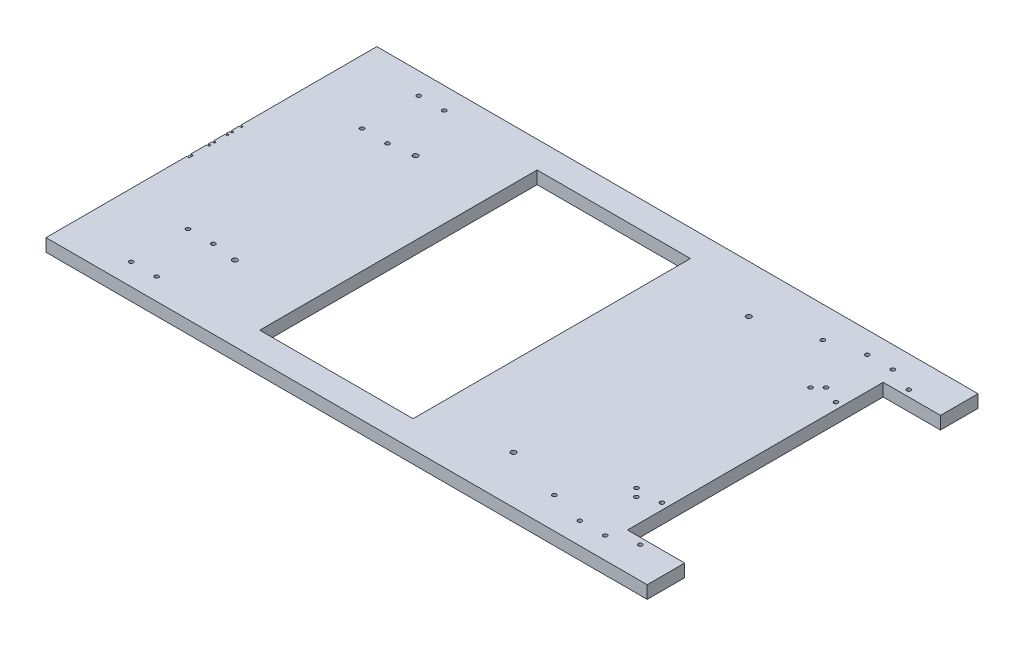
from build123d import *

# Parameters (mm, degrees)
SKETCH1_W               = 600.075
SKETCH1_H               = 330.2
BOSS_EXTRUDE1_DEPTH     = 12.7
CUT_EXTRUDE1_DEPTH      = 2.54
CUT_EXTRUDE2_DEPTH      = 2.54
CUT_EXTRUDE3_REACH      = 344.698
SKETCH4_W               = 153.035
SKETCH4_H               = 276.86
F_5_0MM_DOWEL_HOLE2_D   = 5
CUT_EXTRUDE4_REACH      = 344.698
SKETCH18_W              = 57.15
SKETCH18_H              = 255.27
SKETCH19_R              = 2.032
CUT_EXTRUDE5_DEPTH      = 12.7
CUT_EXTRUDE6_REACH      = 344.698
SKETCH20_R              = 2.0193
CUT_EXTRUDE7_REACH      = 344.698
SKETCH21_R              = 2.0193
LPATTERN1_COUNT         = 2
LPATTERN1_PITCH         = 447.675
MIRROR5_COPY_1_REACH    = 344.698
MIRROR5_COPY_1_SKETCH_R = 2.0193
MIRROR5_COPY_2_REACH    = 344.698
MIRROR5_COPY_2_SKETCH_R = 2.0193
CUT_EXTRUDE8_REACH      = 344.698
SKETCH22_R              = 2.032
SKETCH23_R              = 3.6068
SKETCH23_R_2            = 2.0193
SKETCH23_R_3            = 4.08813
SKETCH23_R_4            = 2.50063
SKETCH23_R_5            = 3.6195
SKETCH23_R_6            = 2.032
BOSS_EXTRUDE2_DEPTH     = 12.7


with BuildPart() as part:
    # Sketch1 → Boss-Extrude1 (new body)
    with BuildSketch(Plane(origin=(0, 0, 0), x_dir=(1, 0, 0), z_dir=(0, 1, 0))):
        Rectangle(SKETCH1_W, SKETCH1_H)
    extrude(amount=BOSS_EXTRUDE1_DEPTH)

    # Sketch2 → Cut-Extrude1 (cut)
    # profile 1 of 4: a face of its own
    with BuildSketch(Plane.ZY.offset(300.0375)):
        with BuildLine():
            Line((-29.307692308, 25.4), (-25.590805288, 25.4))
            add(Edge.make_bspline(
                [(-25.590805288, 25.4), (-25.408858857, 25.399043416), (-25.056201391, 25.397189317), (-24.543378429, 25.368433989), (-24.06305276, 25.329225443), (-23.615085084, 25.267013082), (-23.199682404, 25.191946409), (-22.815592836, 25.10104081), (-22.464037755, 24.992038813), (-22.044324147, 24.818704053), (-21.56578455, 24.561130809), (-21.047633298, 24.180519618), (-20.604561653, 23.71497864), (-20.222547555, 23.18983733), (-19.918830032, 22.612155487), (-19.699105714, 21.995701902), (-19.559997849, 21.34842785), (-19.545691658, 20.904055696), (-19.538461538, 20.679477163)],
                knots=[0, 0, 0, 0, 1.001505555, 1.941167018, 2.826882275, 3.653841531, 4.429895133, 5.150066043, 5.825578002, 6.45369114, 7.647487171, 8.808567382, 9.977351308, 11.170798116, 12.373658725, 13.556498008, 14.765093433, 16, 16, 16, 16], degree=3))
            add(Edge.make_bspline(
                [(-19.538461538, 20.679477163), (-19.54441177, 20.469096825), (-19.556104537, 20.055679619), (-19.667915841, 19.451010253), (-19.842961765, 18.875421476), (-20.08628605, 18.331013921), (-20.402526915, 17.830088113), (-20.777312907, 17.368603136), (-21.229488074, 16.966098097), (-21.568269138, 16.741074585), (-21.740354567, 16.626772837)],
                knots=[0, 0, 0, 0, 1.044552857, 2.05264487, 3.044412934, 4.028983338, 5.005914585, 5.980388656, 6.974128949, 8, 8, 8, 8], degree=3))
            add(Edge.make_bspline(
                [(-21.740354567, 16.626772837), (-21.52394424, 16.543687628), (-21.109897675, 16.384725042), (-20.540106664, 16.103680588), (-20.049189008, 15.797998245), (-19.633370256, 15.464177746), (-19.277746735, 15.104356933), (-18.967215724, 14.713259811), (-18.702249959, 14.285784572), (-18.475212475, 13.826388187), (-18.298054246, 13.339761552), (-18.165379681, 12.830469185), (-18.08935685, 12.30033732), (-18.078538403, 11.939555469), (-18.073076923, 11.757421875)],
                knots=[0, 0, 0, 0, 1.27268992, 2.434971085, 3.483601985, 4.442670788, 5.356604649, 6.2567628, 7.179492994, 8.113709626, 9.066344395, 10.018646069, 10.999752585, 12, 12, 12, 12], degree=3))
            add(Edge.make_bspline(
                [(-18.073076923, 11.757421875), (-18.078393756, 11.571456471), (-18.088854775, 11.205564329), (-18.166034336, 10.668054239), (-18.296712475, 10.154384887), (-18.476714, 9.661233821), (-18.711640313, 9.189555089), (-18.997542519, 8.738814324), (-19.338437172, 8.313540324), (-19.719779359, 7.909007461), (-20.151191894, 7.545273362), (-20.616641931, 7.221337873), (-21.121991186, 6.954931449), (-21.658939897, 6.731142817), (-22.233511389, 6.560197923), (-22.84312558, 6.440604342), (-23.487256709, 6.360022641), (-23.929269783, 6.353397568), (-24.155949519, 6.35)],
                knots=[0, 0, 0, 0, 0.978564426, 1.925352924, 2.850884081, 3.763762016, 4.682927383, 5.618979971, 6.567305752, 7.547517671, 8.540179244, 9.531824382, 10.526200242, 11.540722885, 12.589160233, 13.674978461, 14.80764778, 16, 16, 16, 16], degree=3))
            Line((-24.155949519, 6.35), (-29.307692308, 6.35))
            Line((-29.307692308, 6.35), (-29.307692308, 25.4))
        make_face()
        with BuildLine():
            Line((-27.598076923, 23.446153846), (-27.598076923, 17.340384615))
            Line((-27.598076923, 17.340384615), (-26.449429087, 17.340384615))
            add(Edge.make_bspline(
                [(-26.449429087, 17.340384615), (-26.2815235, 17.342561339), (-25.957095691, 17.346767213), (-25.487268825, 17.35881507), (-25.051159798, 17.392550135), (-24.649521392, 17.426275504), (-24.28298609, 17.481110046), (-23.952365929, 17.546381458), (-23.652472137, 17.615412698), (-23.306635468, 17.732812334), (-22.914352706, 17.906317966), (-22.496161096, 18.175586103), (-22.127492054, 18.496302939), (-21.816175933, 18.866368031), (-21.561387786, 19.273853986), (-21.384420279, 19.712259149), (-21.264420061, 20.170657296), (-21.25358044, 20.485353787), (-21.248076923, 20.645132212)],
                knots=[0, 0, 0, 0, 1.156816544, 2.235205308, 3.236616184, 4.169592532, 5.011045266, 5.787822928, 6.49130361, 7.128639758, 8.301311294, 9.436451833, 10.541879658, 11.654887649, 12.756523258, 13.837046038, 14.901820046, 16, 16, 16, 16], degree=3))
            add(Edge.make_bspline(
                [(-21.248076923, 20.645132212), (-21.250940847, 20.750863911), (-21.256558745, 20.958268185), (-21.302568864, 21.260615384), (-21.380769519, 21.544970665), (-21.481213601, 21.815230894), (-21.621577749, 22.062945393), (-21.786841743, 22.296679073), (-21.986516714, 22.508472175), (-22.213795801, 22.706426159), (-22.475099877, 22.881928517), (-22.770273051, 23.035638957), (-23.103308837, 23.159413755), (-23.468594519, 23.267814528), (-23.871752866, 23.343950813), (-24.308131507, 23.407378537), (-24.781304763, 23.439669604), (-25.108665964, 23.443944222), (-25.277884615, 23.446153846)],
                knots=[0, 0, 0, 0, 0.91205012, 1.789085906, 2.630437955, 3.453916878, 4.269457761, 5.079663411, 5.91843418, 6.774407191, 7.675494373, 8.627863946, 9.638891023, 10.736472738, 11.911756761, 13.175263542, 14.539845004, 16, 16, 16, 16], degree=3))
            Line((-25.277884615, 23.446153846), (-27.598076923, 23.446153846))
        make_face(mode=Mode.SUBTRACT)
        with BuildLine():
            Line((-27.598076923, 15.386538462), (-27.598076923, 8.303846154))
            Line((-27.598076923, 8.303846154), (-25.163401442, 8.303846154))
            add(Edge.make_bspline(
                [(-25.163401442, 8.303846154), (-24.989127003, 8.305934836), (-24.653235995, 8.309960496), (-24.168270728, 8.323102571), (-23.718782692, 8.352996243), (-23.306822982, 8.400054368), (-22.927943233, 8.451099927), (-22.586688592, 8.519741327), (-22.280292782, 8.598384955), (-21.92501405, 8.719946664), (-21.524944954, 8.908794599), (-21.093811579, 9.19353346), (-20.710491735, 9.532750321), (-20.384980252, 9.925348582), (-20.118209558, 10.35223909), (-19.924142009, 10.804787352), (-19.804448918, 11.275515723), (-19.78995911, 11.596463115), (-19.782692308, 11.757421875)],
                knots=[0, 0, 0, 0, 1.160039823, 2.235823828, 3.228722157, 4.157150951, 4.99529583, 5.772374946, 6.472645482, 7.099169577, 8.269452708, 9.405989375, 10.527446681, 11.663510218, 12.788923519, 13.866172445, 14.929861265, 16, 16, 16, 16], degree=3))
            add(Edge.make_bspline(
                [(-19.782692308, 11.757421875), (-19.784195104, 11.858078486), (-19.787176457, 12.057768106), (-19.832137804, 12.351224208), (-19.897527581, 12.635482176), (-19.982062957, 12.911313877), (-20.105177485, 13.173732397), (-20.248904537, 13.427927757), (-20.417423023, 13.674235981), (-20.680009126, 13.985634103), (-21.061945213, 14.344410988), (-21.604634948, 14.695679393), (-22.22170417, 14.978968171), (-22.669256667, 15.099252464), (-22.900450721, 15.161388221)],
                knots=[0, 0, 0, 0, 0.723448775, 1.435228256, 2.130040452, 2.821711965, 3.505591119, 4.210454504, 4.921174351, 5.648778258, 7.137944449, 8.670945889, 10.280296675, 12, 12, 12, 12], degree=3))
            add(Edge.make_bspline(
                [(-22.900450721, 15.161388221), (-22.993137657, 15.18019375), (-23.194102053, 15.220968014), (-23.521803312, 15.264008514), (-23.895922827, 15.302353768), (-24.317324487, 15.330717355), (-24.786541451, 15.360035542), (-25.304575823, 15.371437354), (-25.869312064, 15.38504047), (-26.261156262, 15.386026358), (-26.46469351, 15.386538462)],
                knots=[0, 0, 0, 0, 0.634451884, 1.375622551, 2.216452059, 3.157844607, 4.20941857, 5.370758133, 6.634282058, 8, 8, 8, 8], degree=3))
            Line((-26.46469351, 15.386538462), (-27.598076923, 15.386538462))
        make_face(mode=Mode.SUBTRACT)
    # profile 2 of 4: a face of its own
    with BuildSketch(Plane.ZY.offset(300.0375)):
        with BuildLine():
            Line((-0.488461538, 20.271153846), (-0.488461538, 6.35))
            Line((-0.488461538, 6.35), (-2.198076923, 6.35))
            Line((-2.198076923, 6.35), (-2.198076923, 8.75796274))
            add(Edge.make_bspline(
                [(-2.198076923, 8.75796274), (-2.390856341, 8.54003295), (-2.767067798, 8.114740225), (-3.395397312, 7.559121543), (-4.061429823, 7.099862393), (-4.761932728, 6.728932138), (-5.496273452, 6.450301088), (-6.262824156, 6.252256422), (-7.061897529, 6.124927119), (-7.607556774, 6.112212486), (-7.884074519, 6.105769231)],
                knots=[0, 0, 0, 0, 1.074387032, 2.096679803, 3.090159297, 4.057316773, 5.018401886, 5.985159533, 6.978961417, 8, 8, 8, 8], degree=3))
            add(Edge.make_bspline(
                [(-7.884074519, 6.105769231), (-8.129917239, 6.1124442), (-8.614729969, 6.125607534), (-9.327902517, 6.227728073), (-10.014204618, 6.391724742), (-10.674284792, 6.619785298), (-11.303871755, 6.92230377), (-11.908355995, 7.284478277), (-12.484605933, 7.715774795), (-13.023838167, 8.208832492), (-13.520400912, 8.744382351), (-13.956162981, 9.31558597), (-14.319490459, 9.919973367), (-14.623311184, 10.54989239), (-14.857334144, 11.210192167), (-15.020476354, 11.898589324), (-15.122477928, 12.614269921), (-15.135635821, 13.101620754), (-15.142307692, 13.348737981)],
                knots=[0, 0, 0, 0, 1.033919861, 2.038935746, 3.024066025, 3.998881131, 4.97069526, 5.957263378, 6.95902576, 7.993208707, 9.027059324, 10.027763471, 11.009749337, 11.988697705, 12.965288445, 13.950418724, 14.960734635, 16, 16, 16, 16], degree=3))
            add(Edge.make_bspline(
                [(-15.142307692, 13.348737981), (-15.135487948, 13.590747567), (-15.122005682, 14.069187465), (-15.021567442, 14.772832949), (-14.852670095, 15.450568054), (-14.615645381, 16.100210845), (-14.311705598, 16.722547404), (-13.941982724, 17.318017883), (-13.50645006, 17.888262746), (-13.004333387, 18.419873281), (-12.46040271, 18.910931195), (-11.87851376, 19.337700429), (-11.273141329, 19.706273563), (-10.634895514, 19.99830177), (-9.97322313, 20.234571324), (-9.282233661, 20.398036479), (-8.564802068, 20.494360471), (-8.077718104, 20.50830923), (-7.830649038, 20.515384615)],
                knots=[0, 0, 0, 0, 1.020392517, 2.01726096, 2.990465484, 3.961182959, 4.928053699, 5.906110375, 6.912531644, 7.948652711, 8.985773172, 9.998621852, 10.987621588, 11.969261332, 12.953316658, 13.946091881, 14.958173133, 16, 16, 16, 16], degree=3))
            add(Edge.make_bspline(
                [(-7.830649038, 20.515384615), (-7.546532663, 20.507559139), (-6.989393859, 20.49221375), (-6.174445694, 20.364509477), (-5.403495036, 20.148762962), (-4.670590634, 19.855297723), (-3.978364329, 19.465323926), (-3.333369514, 18.97339871), (-2.728855955, 18.382624535), (-2.378443224, 17.928851116), (-2.198076923, 17.695282452)],
                knots=[0, 0, 0, 0, 1.038897134, 2.037228247, 3.008116434, 3.962042015, 4.918381754, 5.904844433, 6.921570401, 8, 8, 8, 8], degree=3))
            Line((-2.198076923, 17.695282452), (-2.198076923, 20.271153846))
            Line((-2.198076923, 20.271153846), (-0.488461538, 20.271153846))
        make_face()
        with BuildLine():
            add(Edge.make_bspline(
                [(-7.807752404, 18.805769231), (-8.057657586, 18.796877574), (-8.550930666, 18.779326858), (-9.275070162, 18.64231112), (-9.968018888, 18.414339256), (-10.626311092, 18.102562051), (-11.2395481, 17.710519928), (-11.787609365, 17.236330684), (-12.274977497, 16.692932079), (-12.684869621, 16.082776306), (-13.019009325, 15.428664125), (-13.253961313, 14.744908255), (-13.40891536, 14.043841163), (-13.424746022, 13.568338544), (-13.432692308, 13.329657452)],
                knots=[0, 0, 0, 0, 1.031046209, 2.035121221, 3.029706178, 4.034933723, 5.034054252, 6.02443088, 7.017295772, 8.038157696, 9.050218397, 10.03989886, 11.016116709, 12, 12, 12, 12], degree=3))
            add(Edge.make_bspline(
                [(-13.432692308, 13.329657452), (-13.42254196, 13.092402726), (-13.40228105, 12.618823232), (-13.256680842, 11.916800378), (-13.012406102, 11.232883378), (-12.679074304, 10.572877113), (-12.261679961, 9.960097938), (-11.777871723, 9.406340985), (-11.222970906, 8.930147655), (-10.608322618, 8.531526004), (-9.951870665, 8.209512855), (-9.261531695, 7.98545416), (-8.550282864, 7.840795097), (-8.066672304, 7.823897873), (-7.823016827, 7.815384615)],
                knots=[0, 0, 0, 0, 0.979072187, 1.954306742, 2.945804271, 3.96968567, 4.997920485, 5.998718438, 6.996577872, 8.005894225, 9.015743152, 10.005417472, 10.995077863, 12, 12, 12, 12], degree=3))
            add(Edge.make_bspline(
                [(-7.823016827, 7.815384615), (-7.575658005, 7.824419562), (-7.083685841, 7.842389174), (-6.357398017, 7.97999149), (-5.652575433, 8.207333092), (-4.978819233, 8.522469768), (-4.351170005, 8.913034805), (-3.787845843, 9.3702734), (-3.311508929, 9.902057874), (-2.907689154, 10.486492568), (-2.591048672, 11.127182149), (-2.360401835, 11.809358244), (-2.224037005, 12.533044602), (-2.206849934, 13.027603976), (-2.198076923, 13.280048077)],
                knots=[0, 0, 0, 0, 1.01762866, 2.023962475, 3.030623092, 4.058876274, 5.077231937, 6.066672613, 7.034107872, 8.005628644, 8.981990164, 9.965428785, 10.961468474, 12, 12, 12, 12], degree=3))
            add(Edge.make_bspline(
                [(-2.198076923, 13.280048077), (-2.203300196, 13.47238684), (-2.213581249, 13.850970393), (-2.292124777, 14.406835882), (-2.417065163, 14.93878659), (-2.593120745, 15.447381798), (-2.824394736, 15.929809525), (-3.103329005, 16.389533705), (-3.434828667, 16.824163327), (-3.813557341, 17.227713471), (-4.228113658, 17.595794644), (-4.666778229, 17.924348583), (-5.134748266, 18.194253188), (-5.624153853, 18.417634966), (-6.135844116, 18.595394053), (-6.673982775, 18.713981358), (-7.232849833, 18.795408248), (-7.614100506, 18.802279207), (-7.807752404, 18.805769231)],
                knots=[0, 0, 0, 0, 1.050140795, 2.067009409, 3.05949893, 4.030605086, 5.00011959, 5.97591094, 6.962425594, 7.979863591, 8.993523472, 9.986985069, 10.967611495, 11.937549037, 12.921786183, 13.919465291, 14.943216303, 16, 16, 16, 16], degree=3))
        make_face(mode=Mode.SUBTRACT)
    # profile 3 of 4: a face of its own
    with BuildSketch(Plane.ZY.offset(300.0375)):
        with BuildLine():
            Line((17.096153846, 17.252614183), (15.665114183, 16.363461538))
            add(Edge.make_bspline(
                [(15.665114183, 16.363461538), (15.508197344, 16.558470368), (15.199333188, 16.94231214), (14.662998202, 17.437666205), (14.091436076, 17.863118247), (13.474879845, 18.209848662), (12.814194276, 18.477753985), (12.111984871, 18.667329818), (11.368351766, 18.785462911), (10.858545469, 18.798889552), (10.597325721, 18.805769231)],
                knots=[0, 0, 0, 0, 1.026593902, 2.0206758, 2.988051866, 3.946915611, 4.916868779, 5.907761954, 6.927957743, 8, 8, 8, 8], degree=3))
            add(Edge.make_bspline(
                [(10.597325721, 18.805769231), (10.388543399, 18.80001699), (9.977352291, 18.788688107), (9.373705942, 18.71787385), (8.798709705, 18.589193777), (8.248759561, 18.419643569), (7.727766997, 18.192402706), (7.234366998, 17.915852462), (6.764183117, 17.594451528), (6.330840568, 17.222102702), (5.934442686, 16.817161383), (5.591004311, 16.383073412), (5.291990432, 15.932840861), (5.05737087, 15.455220664), (4.865373156, 14.961139575), (4.739062293, 14.441271303), (4.654890166, 13.902276005), (4.645259963, 13.534783327), (4.640384615, 13.348737981)],
                knots=[0, 0, 0, 0, 1.112346261, 2.190735716, 3.231507886, 4.247384806, 5.251966152, 6.253067467, 7.256802811, 8.280671706, 9.291813951, 10.270744147, 11.225547591, 12.165006084, 13.100104208, 14.043489273, 15.009504848, 16, 16, 16, 16], degree=3))
            add(Edge.make_bspline(
                [(4.640384615, 13.348737981), (4.650068831, 13.105065561), (4.669306776, 12.621003995), (4.820081864, 11.906476041), (5.066884995, 11.215648526), (5.404657011, 10.553426237), (5.831796842, 9.940592335), (6.333478937, 9.390953819), (6.909981376, 8.915160865), (7.55622449, 8.520703265), (8.257034494, 8.203594964), (9.004829207, 7.97767648), (9.793498012, 7.841319996), (10.333466164, 7.824142648), (10.608774038, 7.815384615)],
                knots=[0, 0, 0, 0, 0.966302908, 1.919585723, 2.883856336, 3.870342332, 4.860282998, 5.839159637, 6.814385684, 7.815993281, 8.834850808, 9.858348828, 10.908058873, 12, 12, 12, 12], degree=3))
            add(Edge.make_bspline(
                [(10.608774038, 7.815384615), (10.861078685, 7.822457593), (11.356924268, 7.836357871), (12.081734777, 7.953536943), (12.77177972, 8.145363006), (13.427034572, 8.412866644), (14.046301991, 8.758637837), (14.625580785, 9.18513561), (15.176397592, 9.680090535), (15.500231136, 10.062821207), (15.665114183, 10.257692308)],
                knots=[0, 0, 0, 0, 1.039848629, 2.043578496, 3.018386758, 3.987534228, 4.954977003, 5.934852016, 6.948509513, 8, 8, 8, 8], degree=3))
            Line((15.665114183, 10.257692308), (17.096153846, 9.318930288))
            add(Edge.make_bspline(
                [(17.096153846, 9.318930288), (17.01131221, 9.194339332), (16.841910537, 8.945570952), (16.558731604, 8.594810831), (16.253279378, 8.266488532), (15.926745522, 7.961044151), (15.583393711, 7.671168361), (15.21149466, 7.410719077), (14.823040061, 7.165056685), (14.413469645, 6.944006623), (13.987017989, 6.74530793), (13.544285159, 6.574450272), (13.087195036, 6.427655839), (12.615210189, 6.310975423), (12.127400113, 6.217843573), (11.625026389, 6.156046998), (11.108262038, 6.109917253), (10.758982186, 6.107163892), (10.582061298, 6.105769231)],
                knots=[0, 0, 0, 0, 0.954134338, 1.905101784, 2.851144739, 3.791306361, 4.734911809, 5.6936923, 6.663572882, 7.643865596, 8.638447847, 9.640600242, 10.646758161, 11.676244097, 12.717260333, 13.78922464, 14.880174919, 16, 16, 16, 16], degree=3))
            add(Edge.make_bspline(
                [(10.582061298, 6.105769231), (10.312036345, 6.110620339), (9.782785478, 6.120128548), (9.008144401, 6.224677535), (8.267841441, 6.382289704), (7.562129521, 6.60851517), (6.890898775, 6.899734018), (6.254775089, 7.255462367), (5.655864761, 7.678654252), (5.100090358, 8.161777326), (4.589651344, 8.685601386), (4.151358793, 9.250841653), (3.771200963, 9.836716499), (3.465924479, 10.456165491), (3.222917636, 11.10095559), (3.05688419, 11.776252182), (2.949498047, 12.476488022), (2.937069938, 12.954005566), (2.930769231, 13.19609375)],
                knots=[0, 0, 0, 0, 1.1129367, 2.181364009, 3.217532258, 4.231199276, 5.232079859, 6.230262199, 7.231623845, 8.250719726, 9.263571943, 10.242672461, 11.195837495, 12.138959767, 13.085126421, 14.0317438, 15.002148558, 16, 16, 16, 16], degree=3))
            add(Edge.make_bspline(
                [(2.930769231, 13.19609375), (2.933169619, 13.360350658), (2.937944386, 13.687084759), (2.992710021, 14.172016479), (3.063458853, 14.650490133), (3.183341793, 15.11644072), (3.321811517, 15.576935227), (3.498571197, 16.02642325), (3.705918989, 16.466993541), (3.94133316, 16.897511183), (4.206339044, 17.310893677), (4.499606899, 17.701438623), (4.810091072, 18.073837632), (5.152316767, 18.415234101), (5.511761169, 18.739281085), (5.898593602, 19.037321733), (6.310595309, 19.310231984), (6.741578822, 19.563058225), (7.191293322, 19.788171722), (7.657020485, 19.982118345), (8.135953973, 20.147867365), (8.628859901, 20.279088769), (9.132466643, 20.389129316), (9.650742783, 20.458350736), (10.181705592, 20.507261736), (10.541239087, 20.512654476), (10.723257212, 20.515384615)],
                knots=[0, 0, 0, 0, 0.990994727, 1.971252077, 2.943264845, 3.907940874, 4.872158414, 5.844625996, 6.82015047, 7.809835459, 8.804511986, 9.781214284, 10.756496977, 11.728388426, 12.696359165, 13.676225489, 14.672885716, 15.677705647, 16.690706858, 17.706033469, 18.721040654, 19.747369689, 20.783475414, 21.830280724, 22.901553713, 24, 24, 24, 24], degree=3))
            add(Edge.make_bspline(
                [(10.723257212, 20.515384615), (10.951204657, 20.510366894), (11.405960159, 20.500356532), (12.080551719, 20.416108439), (12.745207275, 20.289091659), (13.388265081, 20.100916685), (14.001928252, 19.873058788), (14.576342631, 19.617175299), (15.097986625, 19.320024672), (15.576563932, 18.994976621), (16.01296959, 18.628340834), (16.411683328, 18.215734395), (16.780881305, 17.759304673), (16.990195691, 17.422904907), (17.096153846, 17.252614183)],
                knots=[0, 0, 0, 0, 1.095225653, 2.184976855, 3.262915854, 4.344593502, 5.400796181, 6.407717688, 7.363229445, 8.282371371, 9.184954523, 10.097238608, 11.036792983, 12, 12, 12, 12], degree=3))
        make_face()
    # profile 4 of 4: a face of its own
    with BuildSketch(Plane.ZY.offset(300.0375)):
        Polygon((20.515384615, 25.888461538), (22.225, 25.888461538), (22.225, 14.592788462), (28.559735577, 20.271153846), (31.017307692, 20.271153846), (23.667487981, 13.676923077), (31.75, 6.35), (29.29624399, 6.35), (22.225, 12.764873798), (22.225, 6.35), (20.515384615, 6.35), align=None)
    extrude(amount=-CUT_EXTRUDE1_DEPTH, mode=Mode.SUBTRACT)

    # Sketch3 → Cut-Extrude2 (cut)
    # profile 1 of 5: a face of its own
    with BuildSketch(Plane(origin=(300.0375, 0, 0), x_dir=(0, 0, -1), z_dir=(1, 0, 0))):
        Polygon((-28.941346154, 25.4), (-19.660576923, 25.4), (-19.660576923, 23.446153846), (-27.231730769, 23.446153846), (-27.231730769, 17.584615385), (-19.660576923, 17.584615385), (-19.660576923, 15.630769231), (-27.231730769, 15.630769231), (-27.231730769, 6.35), (-28.941346154, 6.35), align=None)
    # profile 2 of 5: a face of its own
    with BuildSketch(Plane(origin=(300.0375, 0, 0), x_dir=(0, 0, -1), z_dir=(1, 0, 0))):
        with BuildLine():
            Line((-17.218269231, 20.271153846), (-15.508653846, 20.271153846))
            Line((-15.508653846, 20.271153846), (-15.508653846, 18.221905048))
            add(Edge.make_bspline(
                [(-15.508653846, 18.221905048), (-15.382440745, 18.412708914), (-15.14105917, 18.777619824), (-14.739850226, 19.260234162), (-14.32889638, 19.659821773), (-13.906230289, 19.978248068), (-13.468743773, 20.216716615), (-13.026038365, 20.39139442), (-12.571149022, 20.494685236), (-12.265467691, 20.508475579), (-12.112319712, 20.515384615)],
                knots=[0, 0, 0, 0, 1.2804753, 2.448899062, 3.506932113, 4.484331642, 5.4025378, 6.288909075, 7.142734305, 8, 8, 8, 8], degree=3))
            add(Edge.make_bspline(
                [(-12.112319712, 20.515384615), (-11.993522135, 20.508904749), (-11.749088399, 20.495572003), (-11.379068875, 20.401895944), (-10.997832372, 20.252336992), (-10.752128807, 20.111692352), (-10.624038462, 20.038371394)],
                knots=[0, 0, 0, 0, 0.901110191, 1.854092781, 2.881294221, 4, 4, 4, 4], degree=3))
            Line((-10.624038462, 20.038371394), (-11.562800481, 18.557722356))
            add(Edge.make_bspline(
                [(-11.562800481, 18.557722356), (-11.645036724, 18.594408661), (-11.801136858, 18.664046292), (-12.029489568, 18.74646209), (-12.240026558, 18.794990147), (-12.374157926, 18.802341909), (-12.436688702, 18.805769231)],
                knots=[0, 0, 0, 0, 1.180555205, 2.24091978, 3.179933427, 4, 4, 4, 4], degree=3))
            add(Edge.make_bspline(
                [(-12.436688702, 18.805769231), (-12.573879909, 18.796625027), (-12.853710203, 18.777973503), (-13.264561549, 18.631349421), (-13.663235625, 18.394447757), (-13.979855673, 18.131714991), (-14.225014221, 17.878361979), (-14.399948877, 17.657118531), (-14.560419257, 17.40904055), (-14.713745742, 17.138368986), (-14.853443715, 16.840482252), (-14.983825557, 16.518356476), (-15.101711654, 16.171618561), (-15.168932269, 15.930050844), (-15.203365385, 15.806310096)],
                knots=[0, 0, 0, 0, 1.125678352, 2.296057538, 3.5422874, 4.923748041, 5.663163013, 6.437101912, 7.23742474, 8.08941207, 8.991984279, 9.93940061, 10.944477711, 12, 12, 12, 12], degree=3))
            add(Edge.make_bspline(
                [(-15.203365385, 15.806310096), (-15.229123126, 15.695944337), (-15.286174565, 15.451492567), (-15.341645649, 15.041381311), (-15.396452597, 14.556838254), (-15.435078477, 13.996514656), (-15.470881821, 13.361809783), (-15.491075268, 12.651756707), (-15.507965219, 11.86562661), (-15.50841734, 11.31603763), (-15.508653846, 11.028545673)],
                knots=[0, 0, 0, 0, 0.566838948, 1.255505196, 2.06880316, 3.007127437, 4.065329342, 5.249902469, 6.561414163, 8, 8, 8, 8], degree=3))
            Line((-15.508653846, 11.028545673), (-15.508653846, 6.35))
            Line((-15.508653846, 6.35), (-17.218269231, 6.35))
            Line((-17.218269231, 6.35), (-17.218269231, 20.271153846))
        make_face()
    # profile 3 of 5: a face of its own
    with BuildSketch(Plane(origin=(300.0375, 0, 0), x_dir=(0, 0, -1), z_dir=(1, 0, 0))):
        with BuildLine():
            add(Edge.make_bspline(
                [(-2.190444712, 20.515384615), (-1.929235069, 20.509822608), (-1.417066797, 20.498916871), (-0.666998161, 20.382358272), (0.048983221, 20.204119046), (0.733619496, 19.957712401), (1.378142475, 19.627429213), (1.991940247, 19.233315785), (2.573329967, 18.766413383), (2.921798169, 18.405235897), (3.098677885, 18.221905048)],
                knots=[0, 0, 0, 0, 1.054011418, 2.066658804, 3.057071809, 4.030435133, 4.997543892, 5.974964718, 6.972108034, 8, 8, 8, 8], degree=3))
            add(Edge.make_bspline(
                [(3.098677885, 18.221905048), (3.250979663, 18.046568925), (3.552635761, 17.699289917), (3.939436316, 17.136195795), (4.272656522, 16.553047533), (4.53969921, 15.94210137), (4.750256268, 15.308690659), (4.899748129, 14.650638284), (4.988667732, 13.969397509), (5.000658166, 13.506733762), (5.006730769, 13.272415865)],
                knots=[0, 0, 0, 0, 1.025258237, 2.030674902, 3.01204498, 3.988269485, 4.97094183, 5.956517959, 6.965070386, 8, 8, 8, 8], degree=3))
            add(Edge.make_bspline(
                [(5.006730769, 13.272415865), (5.00138949, 13.036739837), (4.990834874, 12.571033014), (4.890993191, 11.885127609), (4.735702566, 11.220038646), (4.513460704, 10.578550613), (4.228482995, 9.958702652), (3.88073511, 9.363202105), (3.467776737, 8.790874065), (2.999669269, 8.246578346), (2.482315486, 7.744930805), (1.921069021, 7.30771551), (1.326959209, 6.933129784), (0.6920861, 6.631397293), (0.022247351, 6.393491639), (-0.684001834, 6.226395835), (-1.425564288, 6.125367242), (-1.931898165, 6.112393793), (-2.190444712, 6.105769231)],
                knots=[0, 0, 0, 0, 0.998656419, 1.973391657, 2.932242238, 3.890759089, 4.846373663, 5.82037756, 6.809684879, 7.83454468, 8.860553229, 9.859544525, 10.845671541, 11.83227036, 12.833544569, 13.85385346, 14.904124723, 16, 16, 16, 16], degree=3))
            add(Edge.make_bspline(
                [(-2.190444712, 6.105769231), (-2.450257971, 6.112416027), (-2.959115364, 6.125434114), (-3.703295352, 6.226003324), (-4.410810277, 6.39341463), (-5.081525935, 6.632179126), (-5.719128602, 6.933139428), (-6.316680821, 7.306583053), (-6.878383219, 7.745060469), (-7.395846448, 8.246543212), (-7.863924571, 8.790883117), (-8.276890517, 9.363199756), (-8.624636435, 9.958703264), (-8.909614659, 10.578550449), (-9.131856383, 11.220038689), (-9.287147045, 11.885127597), (-9.386988718, 12.571033017), (-9.397543336, 13.036739838), (-9.402884615, 13.272415865)],
                knots=[0, 0, 0, 0, 1.099876186, 2.154163076, 3.173186993, 4.173200201, 5.163417411, 6.152872554, 7.150605724, 8.17532212, 9.198891216, 10.186952605, 11.159729845, 12.11414092, 13.071450619, 14.029093627, 15.002601286, 16, 16, 16, 16], degree=3))
            add(Edge.make_bspline(
                [(-9.402884615, 13.272415865), (-9.396770598, 13.505460208), (-9.384665893, 13.966847955), (-9.295835694, 14.6468081), (-9.146926979, 15.303746746), (-8.936117521, 15.934712551), (-8.666613411, 16.542981424), (-8.338075544, 17.127570576), (-7.947329387, 17.688118461), (-7.64687305, 18.03494864), (-7.494831731, 18.210456731)],
                knots=[0, 0, 0, 0, 1.031353054, 2.041901799, 3.029428768, 4.008703097, 4.981709435, 5.96992636, 6.972712378, 8, 8, 8, 8], degree=3))
            add(Edge.make_bspline(
                [(-7.494831731, 18.210456731), (-7.318218685, 18.395377472), (-6.970878055, 18.759056647), (-6.386594265, 19.224597956), (-5.774306468, 19.626912587), (-5.122660798, 19.950633131), (-4.438586957, 20.205568492), (-3.718936509, 20.382817938), (-2.966322632, 20.498496913), (-2.451648122, 20.509699281), (-2.190444712, 20.515384615)],
                knots=[0, 0, 0, 0, 1.027980169, 2.021703884, 2.998553061, 3.971491411, 4.943284454, 5.930300938, 6.949603206, 8, 8, 8, 8], degree=3))
        make_face()
        with BuildLine():
            add(Edge.make_bspline(
                [(-2.198076923, 18.805769231), (-2.382794493, 18.800519096), (-2.747461179, 18.790154358), (-3.28423349, 18.711320534), (-3.800979185, 18.586420547), (-4.298678637, 18.408961327), (-4.775653475, 18.179823034), (-5.232360366, 17.898381817), (-5.670142646, 17.568365296), (-6.080436448, 17.190289898), (-6.45698589, 16.777291371), (-6.786158877, 16.337245303), (-7.066058384, 15.877289333), (-7.299231249, 15.396945155), (-7.472897516, 14.891345016), (-7.599024967, 14.366214723), (-7.677784418, 13.820484385), (-7.688051708, 13.4494937), (-7.693269231, 13.260967548)],
                knots=[0, 0, 0, 0, 1.021534396, 2.016698045, 2.994645724, 3.958388632, 4.93408049, 5.916473867, 6.921342795, 7.962252576, 8.998418191, 10.008913653, 10.997312074, 11.973003931, 12.956656626, 13.948281152, 14.957379055, 16, 16, 16, 16], degree=3))
            add(Edge.make_bspline(
                [(-7.693269231, 13.260967548), (-7.684523519, 13.017388657), (-7.667164917, 12.533930107), (-7.52600313, 11.821943854), (-7.289857807, 11.138419773), (-6.970975613, 10.487364872), (-6.571436052, 9.884991473), (-6.100699303, 9.34793668), (-5.563817505, 8.884282477), (-4.967190554, 8.499576732), (-4.32300491, 8.193907205), (-3.641252648, 7.977287066), (-2.930194013, 7.83647114), (-2.444251748, 7.822474972), (-2.198076923, 7.815384615)],
                knots=[0, 0, 0, 0, 1.016792936, 2.018143844, 3.017858371, 4.030088057, 5.03801393, 6.028138512, 7.003788237, 7.991172063, 8.984598303, 9.972568034, 10.972917682, 12, 12, 12, 12], degree=3))
            add(Edge.make_bspline(
                [(-2.198076923, 7.815384615), (-1.951916258, 7.822516284), (-1.466001943, 7.836593999), (-0.75593128, 7.97657786), (-0.076042376, 8.194856357), (0.567474176, 8.499232956), (1.163829546, 8.885743385), (1.704572621, 9.345318523), (2.171290061, 9.886413914), (2.570434397, 10.488162749), (2.89453881, 11.137410437), (3.129578809, 11.822070008), (3.271079955, 12.533897979), (3.288392751, 13.017377893), (3.297115385, 13.260967548)],
                knots=[0, 0, 0, 0, 1.02726834, 2.027799167, 3.010890988, 4.004497153, 4.992059811, 5.971914811, 6.958719428, 7.966827853, 8.981595046, 9.981490638, 10.983022906, 12, 12, 12, 12], degree=3))
            add(Edge.make_bspline(
                [(3.297115385, 13.260967548), (3.291899658, 13.449494826), (3.281635904, 13.820487729), (3.20285074, 14.366201941), (3.076818446, 14.891391917), (2.902801501, 15.396772106), (2.670641797, 15.878533022), (2.38534468, 16.335894822), (2.057515813, 16.778815737), (1.676422626, 17.188954839), (1.266557098, 17.568512681), (0.82859739, 17.898509786), (0.372567721, 18.178586128), (-0.103021421, 18.410921237), (-0.600784682, 18.584806047), (-1.116806343, 18.712041712), (-1.651288437, 18.789821211), (-2.014648372, 18.800419224), (-2.198076923, 18.805769231)],
                knots=[0, 0, 0, 0, 1.042956736, 2.052379634, 3.044323526, 4.02829302, 5.004299113, 5.996692471, 7.007513377, 8.048758398, 9.090003419, 10.095195979, 11.07790575, 12.047570684, 13.018257071, 13.989683339, 14.985167495, 16, 16, 16, 16], degree=3))
        make_face(mode=Mode.SUBTRACT)
    # profile 4 of 5: a face of its own
    with BuildSketch(Plane(origin=(300.0375, 0, 0), x_dir=(0, 0, -1), z_dir=(1, 0, 0))):
        with BuildLine():
            Line((8.425961538, 20.271153846), (10.135576923, 20.271153846))
            Line((10.135576923, 20.271153846), (10.135576923, 17.76015625))
            add(Edge.make_bspline(
                [(10.135576923, 17.76015625), (10.31811748, 17.987900213), (10.672343799, 18.429845318), (11.262264242, 19.01071016), (11.885710328, 19.489383456), (12.53886409, 19.870948392), (13.222612188, 20.158585029), (13.932786771, 20.366316739), (14.673639671, 20.490875592), (15.177454678, 20.507150988), (15.432331731, 20.515384615)],
                knots=[0, 0, 0, 0, 1.12780773, 2.188550248, 3.19190651, 4.159438251, 5.104880172, 6.052711206, 7.014878035, 8, 8, 8, 8], degree=3))
            add(Edge.make_bspline(
                [(15.432331731, 20.515384615), (15.689945611, 20.505885766), (16.194158114, 20.487294226), (16.928280134, 20.340246236), (17.613935319, 20.089084205), (18.248678902, 19.745029936), (18.820871306, 19.31718613), (19.323382283, 18.818741347), (19.739016529, 18.245412094), (20.017676462, 17.713518915), (20.201240345, 17.241684192), (20.316804925, 16.837569738), (20.414944981, 16.387346658), (20.500026352, 15.892375466), (20.557596061, 15.349188173), (20.603001962, 14.760011449), (20.635543141, 14.125036139), (20.636834225, 13.685870353), (20.6375, 13.459405048)],
                knots=[0, 0, 0, 0, 1.235846778, 2.418850247, 3.575807741, 4.728682307, 5.871620074, 6.994088408, 8.11269785, 9.256955736, 9.865816715, 10.540099792, 11.271859618, 12.076849838, 12.949306005, 13.892391288, 14.913166135, 16, 16, 16, 16], degree=3))
            Line((20.6375, 13.459405048), (20.6375, 6.35))
            Line((20.6375, 6.35), (18.927884615, 6.35))
            Line((18.927884615, 6.35), (18.927884615, 12.8984375))
            add(Edge.make_bspline(
                [(18.927884615, 12.8984375), (18.926833012, 13.087971093), (18.924821473, 13.4505166), (18.918477025, 13.969596569), (18.903183649, 14.44033066), (18.881693545, 14.861593474), (18.850239108, 15.232980499), (18.817458786, 15.555248134), (18.777372269, 15.827987215), (18.741651271, 15.992171449), (18.72563101, 16.065805288)],
                knots=[0, 0, 0, 0, 1.430800155, 2.736877192, 3.918605307, 4.986035426, 5.920637409, 6.731861385, 7.431261377, 8, 8, 8, 8], degree=3))
            add(Edge.make_bspline(
                [(18.72563101, 16.065805288), (18.66779776, 16.281947595), (18.556486646, 16.697954662), (18.281437395, 17.262239353), (17.934105926, 17.74228949), (17.51011906, 18.135137074), (17.013572234, 18.440866914), (16.445843357, 18.652996582), (15.812411041, 18.785673133), (15.36688933, 18.798883666), (15.134675481, 18.805769231)],
                knots=[0, 0, 0, 0, 1.084156227, 2.086665306, 3.027808233, 3.945421172, 4.874247719, 5.839848303, 6.874090471, 8, 8, 8, 8], degree=3))
            add(Edge.make_bspline(
                [(15.134675481, 18.805769231), (14.997147089, 18.803178405), (14.724981954, 18.798051229), (14.32139425, 18.746609164), (13.92992125, 18.662470998), (13.546634112, 18.548885986), (13.179198835, 18.392881349), (12.815810336, 18.215828634), (12.470152091, 17.995130509), (12.134853601, 17.749164412), (11.822908176, 17.476590441), (11.532649649, 17.188965322), (11.273906996, 16.88266525), (11.039490349, 16.562625535), (10.837134372, 16.224450817), (10.66049685, 15.871403663), (10.510623997, 15.503019396), (10.436151057, 15.247340849), (10.398888221, 15.119411058)],
                knots=[0, 0, 0, 0, 1.023777757, 2.026029729, 3.023749952, 4.003683103, 4.997618607, 5.993177895, 7.010360494, 8.046726602, 9.087585522, 10.09234134, 11.086953743, 12.070360549, 13.043493632, 14.017870808, 15.008233677, 16, 16, 16, 16], degree=3))
            add(Edge.make_bspline(
                [(10.398888221, 15.119411058), (10.377445277, 15.025493452), (10.330765109, 14.821039739), (10.280346944, 14.485517971), (10.234585712, 14.097387964), (10.196284552, 13.657102638), (10.172850785, 13.163120489), (10.147299854, 12.617551144), (10.137997679, 12.018219157), (10.136406437, 11.600960515), (10.135576923, 11.38344351)],
                knots=[0, 0, 0, 0, 0.615963638, 1.340920617, 2.168419149, 3.115676021, 4.16674242, 5.331190069, 6.6087489, 8, 8, 8, 8], degree=3))
            Line((10.135576923, 11.38344351), (10.135576923, 6.35))
            Line((10.135576923, 6.35), (8.425961538, 6.35))
            Line((8.425961538, 6.35), (8.425961538, 20.271153846))
        make_face()
    # profile 5 of 5: a face of its own
    with BuildSketch(Plane(origin=(300.0375, 0, 0), x_dir=(0, 0, -1), z_dir=(1, 0, 0))):
        Polygon((26.254807692, 25.888461538), (27.964423077, 25.888461538), (27.964423077, 20.271153846), (30.406730769, 20.271153846), (30.406730769, 18.561538462), (27.964423077, 18.561538462), (27.964423077, 6.35), (26.254807692, 6.35), (26.254807692, 18.561538462), (23.8125, 18.561538462), (23.8125, 20.271153846), (26.254807692, 20.271153846), align=None)
    extrude(amount=-CUT_EXTRUDE2_DEPTH, mode=Mode.SUBTRACT)

    # Sketch4 → Cut-Extrude3 (cut, up to next)
    with BuildSketch(Plane.XZ, mode=Mode.PRIVATE) as cut_extrude3_sk1:
        with Locations((-36.83, 0)):
            Rectangle(SKETCH4_W, SKETCH4_H)
    cut_extrude3_tool1 = extrude(cut_extrude3_sk1.sketch, amount=-CUT_EXTRUDE3_REACH, mode=Mode.PRIVATE) & part.part
    add(cut_extrude3_tool1.solids().sort_by_distance((-36.83, 0, 0))[0], mode=Mode.SUBTRACT)

    # Ø5.0mm Dowel Hole2 (through all)
    with Locations(Plane(origin=(0, 12.7, 0), x_dir=(1, 0, 0), z_dir=(0, 1, 0))):
        with Locations((118.850833333, 117.475), (-186.3725, 90.17), (-186.3725, -90.17), (118.850833333, -117.475)):
            Hole(F_5_0MM_DOWEL_HOLE2_D / 2)

    # Sketch18 → Cut-Extrude4 (cut, up to next)
    with BuildSketch(Plane(origin=(0, 12.7, 0), x_dir=(1, 0, 0), z_dir=(0, 1, 0)), mode=Mode.PRIVATE) as cut_extrude4_sk1:
        with Locations((271.4625, 0)):
            Rectangle(SKETCH18_W, SKETCH18_H)
    cut_extrude4_tool1 = extrude(cut_extrude4_sk1.sketch, amount=-CUT_EXTRUDE4_REACH, mode=Mode.PRIVATE) & part.part
    add(cut_extrude4_tool1.solids().sort_by_distance((271.4625, 12.7, 0))[0], mode=Mode.SUBTRACT)

    # Sketch19 → Cut-Extrude5 (cut)
    with BuildSketch(Plane(origin=(0, 12.7, 0), x_dir=(-1, 0, 0), z_dir=(0, -1, 0))):
        with Locations(Location((-218.758629303, 94.615, 0), (0, 0, 180))):
            Circle(SKETCH19_R)
        with Locations(Location((-218.758629303, -94.615, 0), (0, 0, 180))):
            Circle(SKETCH19_R)
        with Locations(Location((-176.2125, 133.985, 0), (0, 0, 180))):
            Circle(SKETCH19_R)
        with Locations(Location((-176.2125, -133.985, 0), (0, 0, 180))):
            Circle(SKETCH19_R)
    extrude(amount=CUT_EXTRUDE5_DEPTH, mode=Mode.SUBTRACT)

    # Sketch20 → Cut-Extrude6 (cut, up to next)
    with BuildSketch(Plane(origin=(0, 12.7, 0), x_dir=(1, 0, 0), z_dir=(0, 1, 0)), mode=Mode.PRIVATE) as cut_extrude6_sk1:
        with Locations(Location((236.5375, 143.51, 0), (0, 0, 270))):
            Circle(SKETCH20_R)
    cut_extrude6_tool1 = extrude(cut_extrude6_sk1.sketch, amount=-CUT_EXTRUDE6_REACH, mode=Mode.PRIVATE) & part.part
    cut_extrude6 = cut_extrude6_tool1.solids().sort_by_distance((236.5375, 12.7, -143.51))[0]
    add(cut_extrude6, mode=Mode.SUBTRACT)

    # Sketch21 → Cut-Extrude7 (cut, up to next)
    with BuildSketch(Plane(origin=(0, 12.7, 0), x_dir=(1, 0, 0), z_dir=(0, 1, 0)), mode=Mode.PRIVATE) as cut_extrude7_sk1:
        with Locations(Location((211.1375, 143.51, 0), (0, 0, 270))):
            Circle(SKETCH21_R)
    cut_extrude7_tool1 = extrude(cut_extrude7_sk1.sketch, amount=-CUT_EXTRUDE7_REACH, mode=Mode.PRIVATE) & part.part
    # Sketch21 → Cut-Extrude7 (cut, up to next)
    with BuildSketch(Plane(origin=(0, 12.7, 0), x_dir=(1, 0, 0), z_dir=(0, 1, 0)), mode=Mode.PRIVATE) as cut_extrude7_sk2:
        with Locations(Location((211.1375, 86.859999, 0), (0, 0, 270))):
            Circle(SKETCH21_R)
    cut_extrude7_tool2 = extrude(cut_extrude7_sk2.sketch, amount=-CUT_EXTRUDE7_REACH, mode=Mode.PRIVATE) & part.part
    # Sketch21 → Cut-Extrude7 (cut, up to next)
    with BuildSketch(Plane(origin=(0, 12.7, 0), x_dir=(1, 0, 0), z_dir=(0, 1, 0)), mode=Mode.PRIVATE) as cut_extrude7_sk3:
        with Locations(Location((236.5375, 86.859999, 0), (0, 0, 270))):
            Circle(SKETCH21_R)
    cut_extrude7_tool3 = extrude(cut_extrude7_sk3.sketch, amount=-CUT_EXTRUDE7_REACH, mode=Mode.PRIVATE) & part.part
    cut_extrude7_1 = cut_extrude7_tool1.solids().sort_by_distance((211.1375, 12.7, -143.51))[0]
    add(cut_extrude7_1, mode=Mode.SUBTRACT)
    cut_extrude7_2 = cut_extrude7_tool2.solids().sort_by_distance((211.1375, 12.7, -86.859999))[0]
    add(cut_extrude7_2, mode=Mode.SUBTRACT)
    cut_extrude7_3 = cut_extrude7_tool3.solids().sort_by_distance((236.5375, 12.7, -86.859999))[0]
    add(cut_extrude7_3, mode=Mode.SUBTRACT)
    cut_extrude7 = cut_extrude7_1 + cut_extrude7_2 + cut_extrude7_3  # Cut-Extrude7 as one shape, for the pattern or mirror that repeats it

    # LPattern1: Cut-Extrude6, Cut-Extrude7 ×2
    with Locations(*[(-i * LPATTERN1_PITCH, 0, 0) for i in range(1, LPATTERN1_COUNT)]):
        add(cut_extrude6, mode=Mode.SUBTRACT)
        add(cut_extrude7, mode=Mode.SUBTRACT)

    # Mirror5: Cut-Extrude6, Cut-Extrude7 across plane
    add(cut_extrude6.mirror(Plane.XY), mode=Mode.SUBTRACT)
    add(cut_extrude7.mirror(Plane.XY), mode=Mode.SUBTRACT)

    # Mirror5 copy 1 sketch → Mirror5 copy 1 (cut, up to next)
    with BuildSketch(Plane(origin=(-447.675, 12.7, 0), x_dir=(1, 0, 0), z_dir=(0, 1, 0)), mode=Mode.PRIVATE) as mirror5_copy_1_sk1:
        with Locations((236.5375, -143.51)):
            Circle(MIRROR5_COPY_1_SKETCH_R)
    mirror5_copy_1_tool1 = extrude(mirror5_copy_1_sk1.sketch, amount=-MIRROR5_COPY_1_REACH, mode=Mode.PRIVATE) & part.part
    add(mirror5_copy_1_tool1.solids().sort_by_distance((-211.1375, 12.7, 143.51))[0], mode=Mode.SUBTRACT)

    # Mirror5 copy 2 sketch → Mirror5 copy 2 (cut, up to next)
    with BuildSketch(Plane(origin=(-447.675, 12.7, 0), x_dir=(1, 0, 0), z_dir=(0, 1, 0)), mode=Mode.PRIVATE) as mirror5_copy_2_sk1:
        with Locations((211.1375, -143.51)):
            Circle(MIRROR5_COPY_2_SKETCH_R)
    mirror5_copy_2_tool1 = extrude(mirror5_copy_2_sk1.sketch, amount=-MIRROR5_COPY_2_REACH, mode=Mode.PRIVATE) & part.part
    # Mirror5 copy 2 sketch → Mirror5 copy 2 (cut, up to next)
    with BuildSketch(Plane(origin=(-447.675, 12.7, 0), x_dir=(1, 0, 0), z_dir=(0, 1, 0)), mode=Mode.PRIVATE) as mirror5_copy_2_sk2:
        with Locations((211.1375, -86.859999)):
            Circle(MIRROR5_COPY_2_SKETCH_R)
    mirror5_copy_2_tool2 = extrude(mirror5_copy_2_sk2.sketch, amount=-MIRROR5_COPY_2_REACH, mode=Mode.PRIVATE) & part.part
    # Mirror5 copy 2 sketch → Mirror5 copy 2 (cut, up to next)
    with BuildSketch(Plane(origin=(-447.675, 12.7, 0), x_dir=(1, 0, 0), z_dir=(0, 1, 0)), mode=Mode.PRIVATE) as mirror5_copy_2_sk3:
        with Locations((236.5375, -86.859999)):
            Circle(MIRROR5_COPY_2_SKETCH_R)
    mirror5_copy_2_tool3 = extrude(mirror5_copy_2_sk3.sketch, amount=-MIRROR5_COPY_2_REACH, mode=Mode.PRIVATE) & part.part
    add(mirror5_copy_2_tool1.solids().sort_by_distance((-236.5375, 12.7, 143.51))[0], mode=Mode.SUBTRACT)
    add(mirror5_copy_2_tool2.solids().sort_by_distance((-236.5375, 12.7, 86.859999))[0], mode=Mode.SUBTRACT)
    add(mirror5_copy_2_tool3.solids().sort_by_distance((-211.1375, 12.7, 86.859999))[0], mode=Mode.SUBTRACT)

    # Sketch22 → Cut-Extrude8 (cut, up to next)
    with BuildSketch(Plane(origin=(0, 12.7, 0), x_dir=(1, 0, 0), z_dir=(0, 1, 0)), mode=Mode.PRIVATE) as cut_extrude8_sk1:
        with Locations(Location((261.9375, -133.985, 0), (0, 0, 270))):
            Circle(SKETCH22_R)
    cut_extrude8_tool1 = extrude(cut_extrude8_sk1.sketch, amount=-CUT_EXTRUDE8_REACH, mode=Mode.PRIVATE) & part.part
    cut_extrude8 = cut_extrude8_tool1.solids().sort_by_distance((261.9375, 12.7, 133.985))[0]
    add(cut_extrude8, mode=Mode.SUBTRACT)

    # Mirror6: Cut-Extrude8 across plane
    add(cut_extrude8.mirror(Plane.XY), mode=Mode.SUBTRACT)

    # Sketch23 → Boss-Extrude2 (add)
    # profile 1 of 13: a face of its own
    with BuildSketch(Plane(origin=(0, 12.7, 0), x_dir=(1, 0, 0), z_dir=(0, 1, 0))):
        with Locations((-236.5375, 143.51)):
            Circle(SKETCH23_R)
        with Locations(Location((-236.5375, 143.51, 0), (0, 0, 270))):
            Circle(SKETCH23_R_2, mode=Mode.SUBTRACT)
    # profile 2 of 13: a face of its own
    with BuildSketch(Plane(origin=(0, 12.7, 0), x_dir=(1, 0, 0), z_dir=(0, 1, 0))):
        with Locations((-211.1375, 143.51)):
            Circle(SKETCH23_R)
        with Locations(Location((-211.1375, 143.51, 0), (0, 0, 270))):
            Circle(SKETCH23_R_2, mode=Mode.SUBTRACT)
    # profile 3 of 13: a face of its own
    with BuildSketch(Plane(origin=(0, 12.7, 0), x_dir=(1, 0, 0), z_dir=(0, 1, 0))):
        with Locations((-236.5375, 86.859999)):
            Circle(SKETCH23_R)
        with Locations(Location((-236.5375, 86.859999, 0), (0, 0, 270))):
            Circle(SKETCH23_R_2, mode=Mode.SUBTRACT)
    # profile 4 of 13: a face of its own
    with BuildSketch(Plane(origin=(0, 12.7, 0), x_dir=(1, 0, 0), z_dir=(0, 1, 0))):
        with Locations((-211.1375, 86.859999)):
            Circle(SKETCH23_R)
        with Locations(Location((-211.1375, 86.859999, 0), (0, 0, 270))):
            Circle(SKETCH23_R_2, mode=Mode.SUBTRACT)
    # profile 5 of 13: a face of its own
    with BuildSketch(Plane(origin=(0, 12.7, 0), x_dir=(1, 0, 0), z_dir=(0, 1, 0))):
        with Locations((-186.3725, 90.17)):
            Circle(SKETCH23_R_3)
        with Locations((-186.3725, 90.17)):
            Circle(SKETCH23_R_4, mode=Mode.SUBTRACT)
    # profile 6 of 13: a face of its own
    with BuildSketch(Plane(origin=(0, 12.7, 0), x_dir=(1, 0, 0), z_dir=(0, 1, 0))):
        with Locations((118.850833333, 117.475)):
            Circle(SKETCH23_R_3)
        with Locations((118.850833333, 117.475)):
            Circle(SKETCH23_R_4, mode=Mode.SUBTRACT)
    # profile 7 of 13: a face of its own
    with BuildSketch(Plane(origin=(0, 12.7, 0), x_dir=(1, 0, 0), z_dir=(0, 1, 0))):
        with Locations((176.2125, 133.985)):
            Circle(SKETCH23_R_5)
        with Locations((176.2125, 133.985)):
            Circle(SKETCH23_R_6, mode=Mode.SUBTRACT)
    # profile 8 of 13: a face of its own
    with BuildSketch(Plane(origin=(0, 12.7, 0), x_dir=(1, 0, 0), z_dir=(0, 1, 0))):
        with Locations((211.1375, 143.51)):
            Circle(SKETCH23_R)
        with Locations(Location((211.1375, 143.51, 0), (0, 0, 270))):
            Circle(SKETCH23_R_2, mode=Mode.SUBTRACT)
    # profile 9 of 13: a face of its own
    with BuildSketch(Plane(origin=(0, 12.7, 0), x_dir=(1, 0, 0), z_dir=(0, 1, 0))):
        with Locations((211.1375, 86.859999)):
            Circle(SKETCH23_R)
        with Locations(Location((211.1375, 86.859999, 0), (0, 0, 270))):
            Circle(SKETCH23_R_2, mode=Mode.SUBTRACT)
    # profile 10 of 13: a face of its own
    with BuildSketch(Plane(origin=(0, 12.7, 0), x_dir=(1, 0, 0), z_dir=(0, 1, 0))):
        with Locations((218.758629303, 94.615)):
            Circle(SKETCH23_R_5)
        with Locations((218.758629303, 94.615)):
            Circle(SKETCH23_R_6, mode=Mode.SUBTRACT)
    # profile 11 of 13: a face of its own
    with BuildSketch(Plane(origin=(0, 12.7, 0), x_dir=(1, 0, 0), z_dir=(0, 1, 0))):
        with Locations((236.5375, 86.859999)):
            Circle(SKETCH23_R)
        with Locations(Location((236.5375, 86.859999, 0), (0, 0, 270))):
            Circle(SKETCH23_R_2, mode=Mode.SUBTRACT)
    # profile 12 of 13: a face of its own
    with BuildSketch(Plane(origin=(0, 12.7, 0), x_dir=(1, 0, 0), z_dir=(0, 1, 0))):
        with Locations((236.5375, 143.51)):
            Circle(SKETCH23_R)
        with Locations(Location((236.5375, 143.51, 0), (0, 0, 270))):
            Circle(SKETCH23_R_2, mode=Mode.SUBTRACT)
    # profile 13 of 13: a face of its own
    with BuildSketch(Plane(origin=(0, 12.7, 0), x_dir=(1, 0, 0), z_dir=(0, 1, 0))):
        with Locations((261.9375, 133.985)):
            Circle(SKETCH23_R_5)
        with Locations(Location((261.9375, 133.985, 0), (0, 0, 270))):
            Circle(SKETCH23_R_6, mode=Mode.SUBTRACT)
    boss_extrude2 = extrude(amount=-BOSS_EXTRUDE2_DEPTH)

    # Mirror10: Boss-Extrude2 across plane
    add(boss_extrude2.mirror(Plane.XY))


solid = part.part
